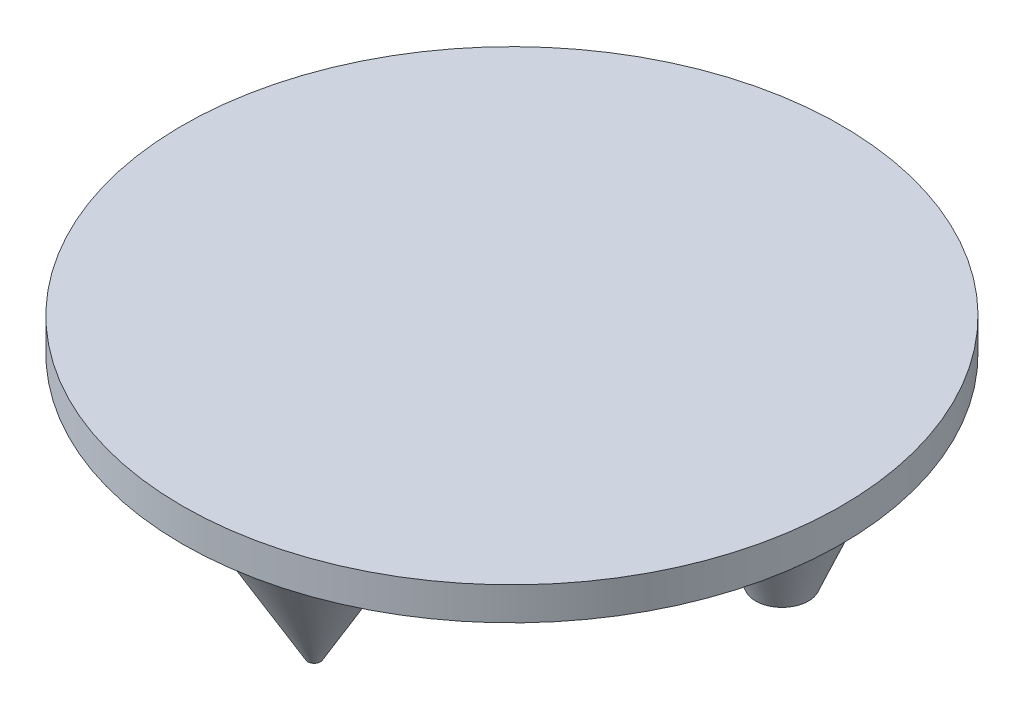
from build123d import *

# Parameters (mm, degrees)
SKETCH2_R           = 12.7
BOSS_EXTRUDE1_DEPTH = 1.27
SKETCH3_R           = 3.175
BOSS_EXTRUDE2_DEPTH = 6.35
CIRPATTERN1_COUNT   = 3
CHAMFER1_SIZE       = 5.08
CHAMFER1_SIZE2      = 2.932939367
CHAMFER2_SIZE       = 5.08
CHAMFER2_SIZE2      = 2.156332066
CHAMFER3_SIZE       = 5.08
CHAMFER3_SIZE2      = 1.45666656
FILLET1_R           = 2.54


with BuildPart() as part:
    # Sketch2 → Boss-Extrude1 (new body)
    with BuildSketch(Plane(origin=(0, 0, 0), x_dir=(1, 0, 0), z_dir=(0, 1, 0))):
        with Locations(Location((0, 0, 0), (0, 0, 270))):
            Circle(SKETCH2_R)
    extrude(amount=BOSS_EXTRUDE1_DEPTH)

    # Sketch3 → Boss-Extrude2 (add)
    with BuildSketch(Plane.XZ):
        with Locations(Location((0, 7.62, 0), (0, 0, 270))):
            Circle(SKETCH3_R)
    boss_extrude2 = extrude(amount=BOSS_EXTRUDE2_DEPTH)

    # CirPattern1: Boss-Extrude2 ×3 about axis
    cirpattern1_axis = Axis((0, 0, 0), (0, 1, 0))
    for i in range(1, CIRPATTERN1_COUNT):
        add(boss_extrude2.rotate(cirpattern1_axis, i * 360 / CIRPATTERN1_COUNT))

    # Chamfer1
    chamfer1_edges = [part.edges().sort_by_distance(p)[0] for p in [
        (0, -6.35, 10.795),
    ]]
    chamfer1_side = [part.faces().sort_by_distance(p)[0] for p in [
        (0, -3.175, 10.795),
    ]]
    chamfer(chamfer1_edges, length=CHAMFER1_SIZE, length2=CHAMFER1_SIZE2, reference=chamfer1_side[0])

    # Chamfer2
    chamfer2_edges = [part.edges().sort_by_distance(p)[0] for p in [
        (9.348744234, -6.35, -5.3975),
    ]]
    chamfer2_side = [part.faces().sort_by_distance(p)[0] for p in [
        (9.348744234, -3.175, -5.3975),
    ]]
    chamfer(chamfer2_edges, length=CHAMFER2_SIZE, length2=CHAMFER2_SIZE2, reference=chamfer2_side[0])

    # Chamfer3
    chamfer3_edges = [part.edges().sort_by_distance(p)[0] for p in [
        (-9.348744234, -6.35, -5.3975),
    ]]
    chamfer3_side = [part.faces().sort_by_distance(p)[0] for p in [
        (-9.348744234, -3.175, -5.3975),
    ]]
    chamfer(chamfer3_edges, length=CHAMFER3_SIZE, length2=CHAMFER3_SIZE2, reference=chamfer3_side[0])

    # Fillet1
    fillet1_edges = [part.edges().sort_by_distance(p)[0] for p in [
        (0, -1.27, 10.795),
        (9.348744234, -1.27, -5.3975),
        (-9.348744234, -1.27, -5.3975),
    ]]
    fillet(fillet1_edges, radius=FILLET1_R)


solid = part.part
